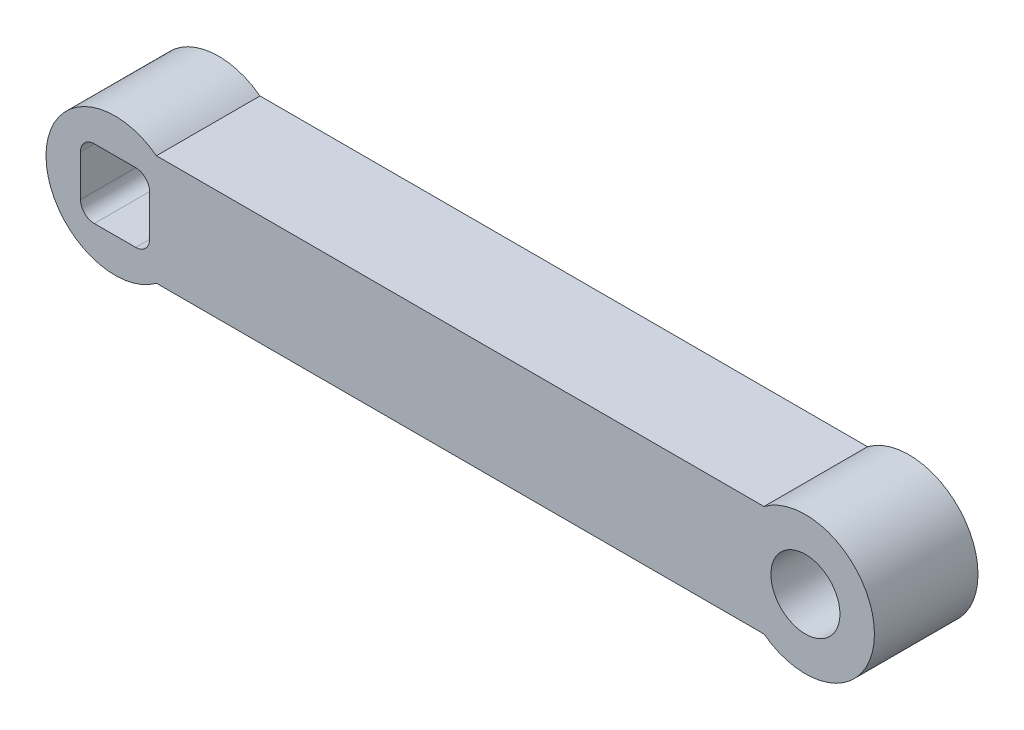
from build123d import *

# Parameters (mm, degrees)
SKETCH1_R           = 2.5
BOSS_EXTRUDE1_DEPTH = 7.5


with BuildPart() as part:
    # Sketch1 → Boss-Extrude1 (new body)
    with BuildSketch(Plane.XY):
        with BuildLine():
            Line((-47, 4), (-3, 4))
            ThreePointArc((-3, 4), (5, 0), (-3, -4))
            Line((-3, -4), (-47, -4))
            ThreePointArc((-47, -4), (-55, 0), (-47, 4))
        make_face()
        Circle(SKETCH1_R, mode=Mode.SUBTRACT)
        with BuildLine():
            Line((-51.5, -2.5), (-48.5, -2.5))
            ThreePointArc((-48.5, -2.5), (-47.792893219, -2.207106781), (-47.5, -1.5))
            Line((-47.5, -1.5), (-47.5, 1.5))
            ThreePointArc((-47.5, 1.5), (-47.792893219, 2.207106781), (-48.5, 2.5))
            Line((-48.5, 2.5), (-51.5, 2.5))
            ThreePointArc((-51.5, 2.5), (-52.207106781, 2.207106781), (-52.5, 1.5))
            Line((-52.5, 1.5), (-52.5, -1.5))
            ThreePointArc((-52.5, -1.5), (-52.207106781, -2.207106781), (-51.5, -2.5))
        make_face(mode=Mode.SUBTRACT)
    extrude(amount=BOSS_EXTRUDE1_DEPTH)


solid = part.part
